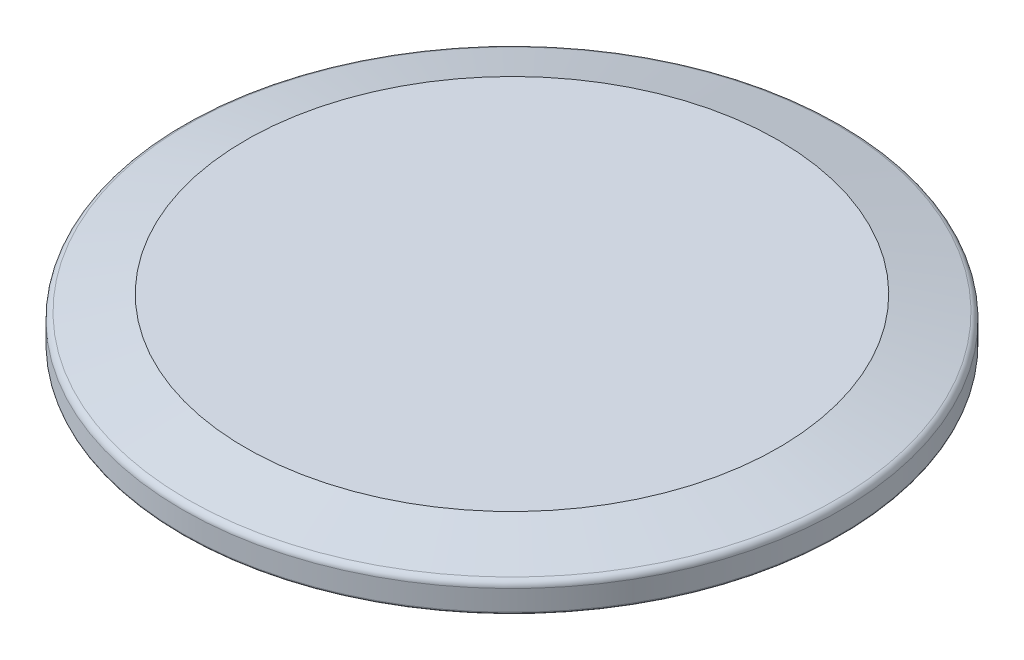
from build123d import *

# Parameters (mm, degrees)
SKETCH2_W = 19.8
SKETCH2_H = 2.5
FILLET1_R = 0.762
FILLET2_R = 0.254


with BuildPart() as part:
    # Sketch1 → Flange (revolve)
    with BuildSketch(Plane(origin=(0, 0, 0), x_dir=(0, 0, -1), z_dir=(1, 0, 0)), mode=Mode.PRIVATE) as flange_sk:
        Polygon((-37.5, 0), (-37.5, 3.175), (-30.315802195, 5.1), (0, 5.1), (0, 2.5), (-26.1, 2.5), (-26.1, 0), align=None)
    revolve(flange_sk.sketch.rotate(Axis((0, 0, 0), (0, 1, 0)), 180), axis=Axis((0, 0, 0), (0, 1, 0)))

    # Sketch2 → Blank Insert (revolve)
    with BuildSketch(Plane(origin=(0, 0, 0), x_dir=(0, 0, -1), z_dir=(1, 0, 0))):
        with Locations((-9.9, 1.25)):
            Rectangle(SKETCH2_W, SKETCH2_H)
    revolve(axis=Axis((0, 0, 0), (0, -1, 0)))

    # Fillet1
    fillet1_edges = [part.edges().sort_by_distance(p)[0] for p in [
        (0, 3.175, 37.5),
    ]]
    fillet(fillet1_edges, radius=FILLET1_R)

    # Fillet2
    fillet2_edges = [part.edges().sort_by_distance(p)[0] for p in [
        (0, 0, 37.5),
    ]]
    fillet(fillet2_edges, radius=FILLET2_R)


solid = part.part
